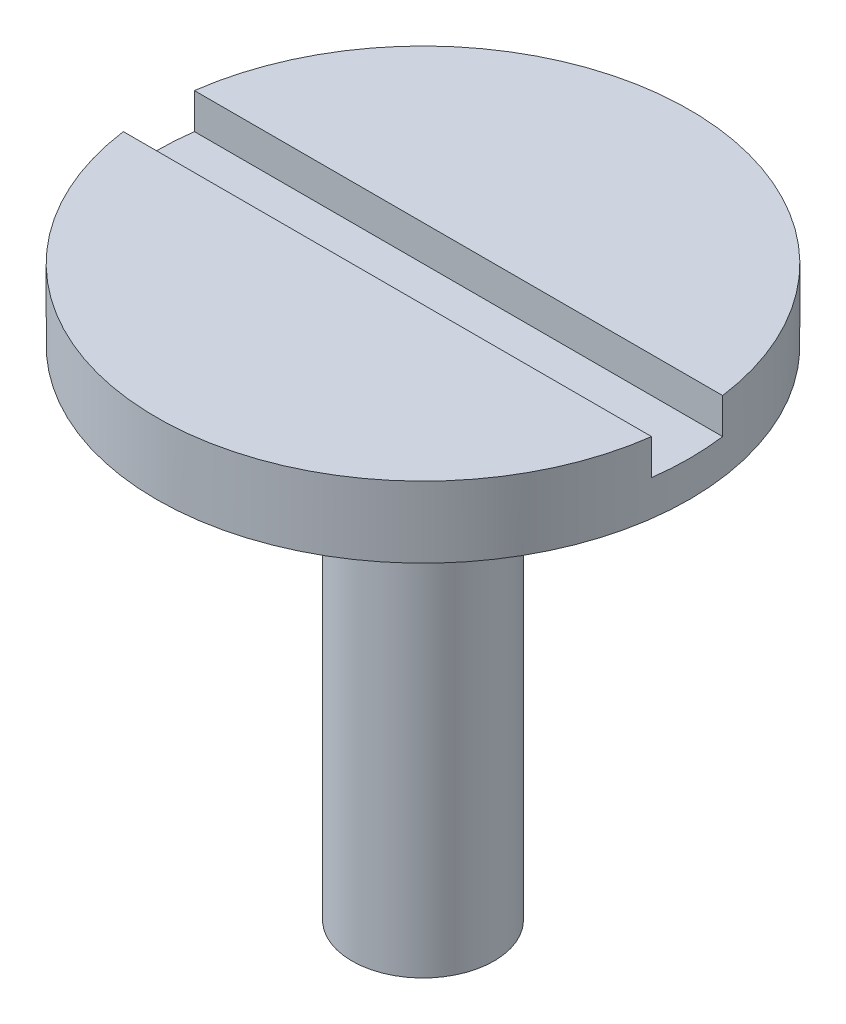
from build123d import *

# Parameters (mm, degrees)
SKETCH_1_R          = 1
EXTRUDE_1_DEPTH     = 7
SKETCH_2_R          = 3.75
EXTRUDE_2_DEPTH     = 1
SKETCH_3_W          = 8.378804874
SKETCH_3_H          = 1
CUT_EXTRUDE_1_DEPTH = 0.5


with BuildPart() as part:
    # 草图1 → 拉伸1 (new body)
    with BuildSketch(Plane(origin=(0, 0, 0), x_dir=(1, 0, 0), z_dir=(0, 1, 0))):
        with Locations(Location((0, 0, 0), (0, 0, 270))):
            Circle(SKETCH_1_R)
    extrude(amount=EXTRUDE_1_DEPTH)

    # 草图2 → 拉伸2 (add)
    with BuildSketch(Plane(origin=(0, 7, 0), x_dir=(-1, 0, 0), z_dir=(0, 1, 0))):
        with Locations(Location((0, 0, 0), (0, 0, 90))):
            Circle(SKETCH_2_R)
    extrude(amount=EXTRUDE_2_DEPTH)

    # 草图3 → 切除-拉伸1 (cut)
    with BuildSketch(Plane(origin=(0, 8, 0), x_dir=(-1, 0, 0), z_dir=(0, 1, 0))):
        Rectangle(SKETCH_3_W, SKETCH_3_H)
    extrude(amount=-CUT_EXTRUDE_1_DEPTH, mode=Mode.SUBTRACT)


solid = part.part
